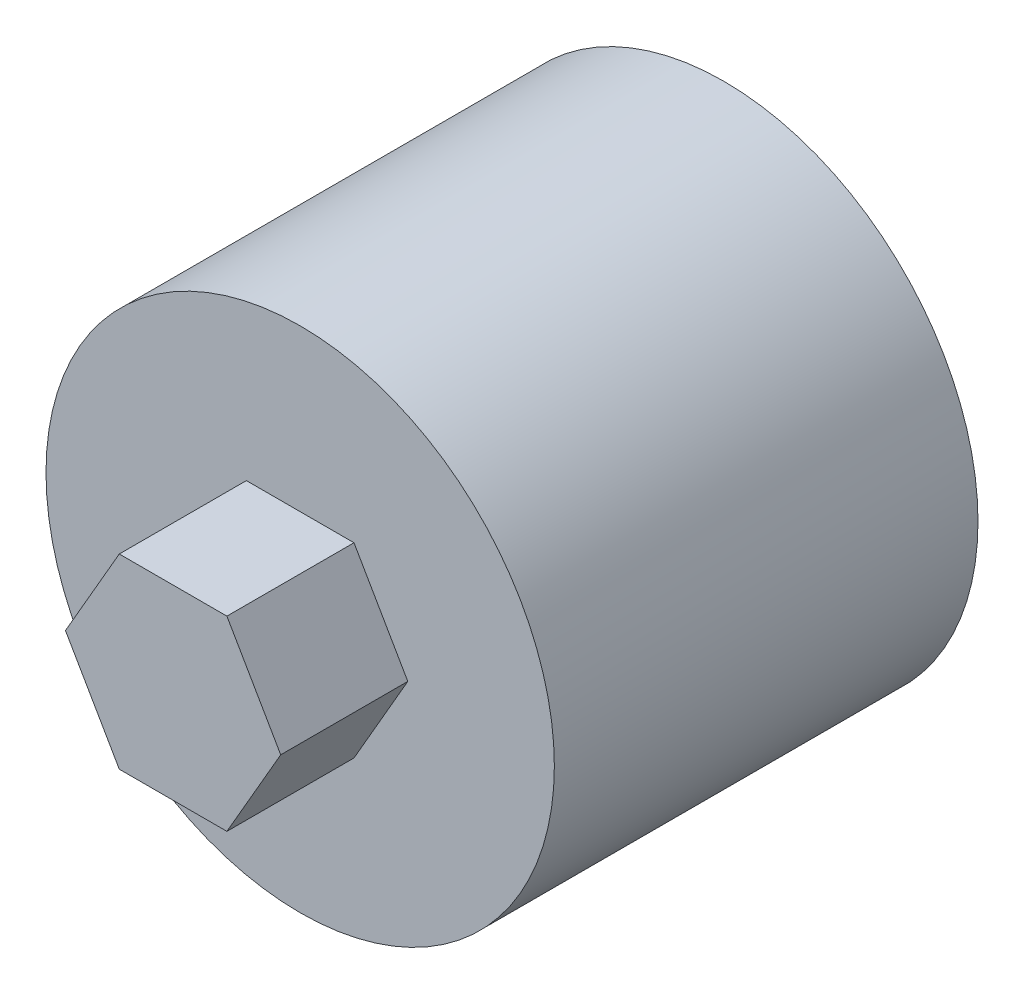
from build123d import *

# Parameters (mm, degrees)
SKETCH_1_R               = 3
SKETCH_1_R_2             = 1.525
EXTRUDE_1_DEPTH          = 4
CUT_EXTRUDE_2_DEPTH      = 6.830951895
PATTERN_CIRCULAR_1_COUNT = 9
SKETCH_2_R               = 3
EXTRUDE_2_DEPTH          = 1
EXTRUDE_START            = 1
EXTRUDE_3_DEPTH          = 1.5


with BuildPart() as part:
    # 草图1 → 凸台-拉伸1 (new body)
    with BuildSketch(Plane.XY):
        Circle(SKETCH_1_R)
        Circle(SKETCH_1_R_2, mode=Mode.SUBTRACT)
    extrude(amount=EXTRUDE_1_DEPTH)

    # 草图1<3> → 切除-拉伸2 (cut, through all)
    with BuildSketch(Plane.XY):
        with BuildLine():
            Line((1.629066618, 0.455119711), (1.468758411, 0.410333682))
            ThreePointArc((1.468758411, 0.410333682), (1.51087418, 0.207085035), (1.525, 0))
            ThreePointArc((1.525, 0), (1.51087418, -0.207085035), (1.468758411, -0.410333682))
            Line((1.468758411, -0.410333682), (1.629066618, -0.455119711))
            add(Edge.make_bspline(
                [(1.629066618, -0.455119711), (1.641483046, -0.458588545), (1.676886801, -0.465581385), (1.74601147, -0.46838824), (1.857617417, -0.457440389), (1.998539397, -0.420943181), (2.163995746, -0.351850331), (2.289812361, -0.276606271), (2.373454255, -0.216312222), (2.418244016, -0.180889134)],
                knots=[0, 0, 0, 0, 0, 0.005604068, 0.015718248, 0.029959916, 0.048733667, 0.068727063, 0.093605144, 0.093605144, 0.093605144, 0.093605144, 0.093605144], degree=4))
            ThreePointArc((2.418244016, -0.180889134), (2.423310415, -0.090507627), (2.425, 0))
            ThreePointArc((2.425, 0), (2.423310415, 0.090507627), (2.418244016, 0.180889134))
            add(Edge.make_bspline(
                [(1.629066618, 0.455119711), (1.641483046, 0.458588545), (1.676886801, 0.465581385), (1.74601147, 0.46838824), (1.857617417, 0.457440389), (1.998539397, 0.420943181), (2.163995746, 0.351850331), (2.289812361, 0.276606271), (2.373454255, 0.216312222), (2.418244016, 0.180889134)],
                knots=[0, 0, 0, 0, 0, 0.005604068, 0.015718248, 0.029959916, 0.048733667, 0.068727063, 0.093605144, 0.093605144, 0.093605144, 0.093605144, 0.093605144], degree=4))
        make_face()
    cut_extrude_2 = extrude(amount=CUT_EXTRUDE_2_DEPTH, mode=Mode.SUBTRACT)

    # 阵列(圆周)1: 切除-拉伸2 ×9 about axis
    pattern_circular_1_axis = Axis((0, 0, 4), (0, 0, 1))
    for i in range(1, PATTERN_CIRCULAR_1_COUNT):
        add(cut_extrude_2.rotate(pattern_circular_1_axis, i * 360 / PATTERN_CIRCULAR_1_COUNT), mode=Mode.SUBTRACT)

    # 草图2 → 凸台-拉伸2 (add)
    with BuildSketch(Plane.XY.offset(4)):
        Circle(SKETCH_2_R)
    extrude(amount=EXTRUDE_2_DEPTH)

    # 草图2<3> → 凸台-拉伸3 (add)
    with BuildSketch(Plane.XY.offset(4).offset(EXTRUDE_START)):
        Polygon((0.635085296, 1.1), (-0.635085296, 1.1), (-1.270170592, 0), (-0.635085296, -1.1), (0.635085296, -1.1), (1.270170592, 0), align=None)
    extrude(amount=EXTRUDE_3_DEPTH)


solid = part.part
